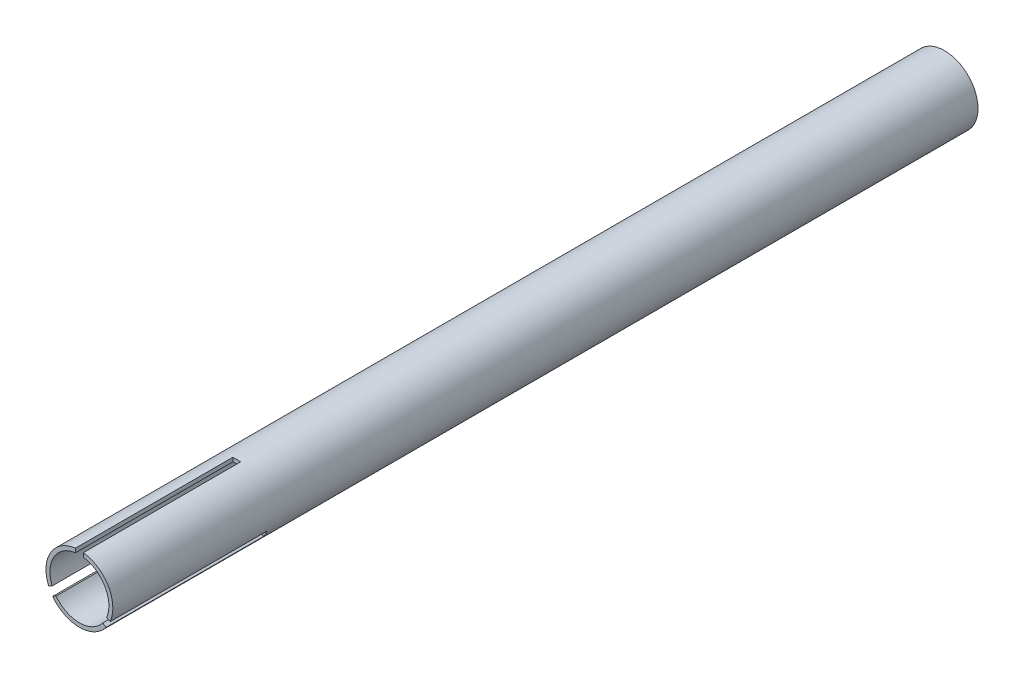
from build123d import *

# Parameters (mm, degrees)
SKETCH1_R           = 21.59
SKETCH1_R_2         = 19.05
BOSS_EXTRUDE1_DEPTH = 558.8
CUT_EXTRUDE1_REACH  = 561.634
SKETCH2_W           = 5.08
SKETCH2_H           = 101.6
CIRPATTERN1_COUNT   = 3


with BuildPart() as part:
    # Sketch1 → Boss-Extrude1 (new body)
    with BuildSketch(Plane.XY):
        Circle(SKETCH1_R)
        Circle(SKETCH1_R_2, mode=Mode.SUBTRACT)
    extrude(amount=BOSS_EXTRUDE1_DEPTH)

    # Sketch2 → Cut-Extrude1 (cut, up to next)
    with BuildSketch(Plane(origin=(0, 0, 0), x_dir=(1, 0, 0), z_dir=(0, 1, 0)), mode=Mode.PRIVATE) as cut_extrude1_sk1:
        with Locations((0, -508)):
            Rectangle(SKETCH2_W, SKETCH2_H)
    cut_extrude1_tool1 = extrude(cut_extrude1_sk1.sketch, amount=CUT_EXTRUDE1_REACH, mode=Mode.PRIVATE) & part.part
    cut_extrude1 = cut_extrude1_tool1.solids().sort_by_distance((0, 0, 508))[0]
    add(cut_extrude1, mode=Mode.SUBTRACT)

    # CirPattern1: Cut-Extrude1 ×3 about axis
    cirpattern1_axis = Axis((0, 0, -27.94), (0, 0, 1))
    for i in range(1, CIRPATTERN1_COUNT):
        add(cut_extrude1.rotate(cirpattern1_axis, i * 360 / CIRPATTERN1_COUNT), mode=Mode.SUBTRACT)


solid = part.part
